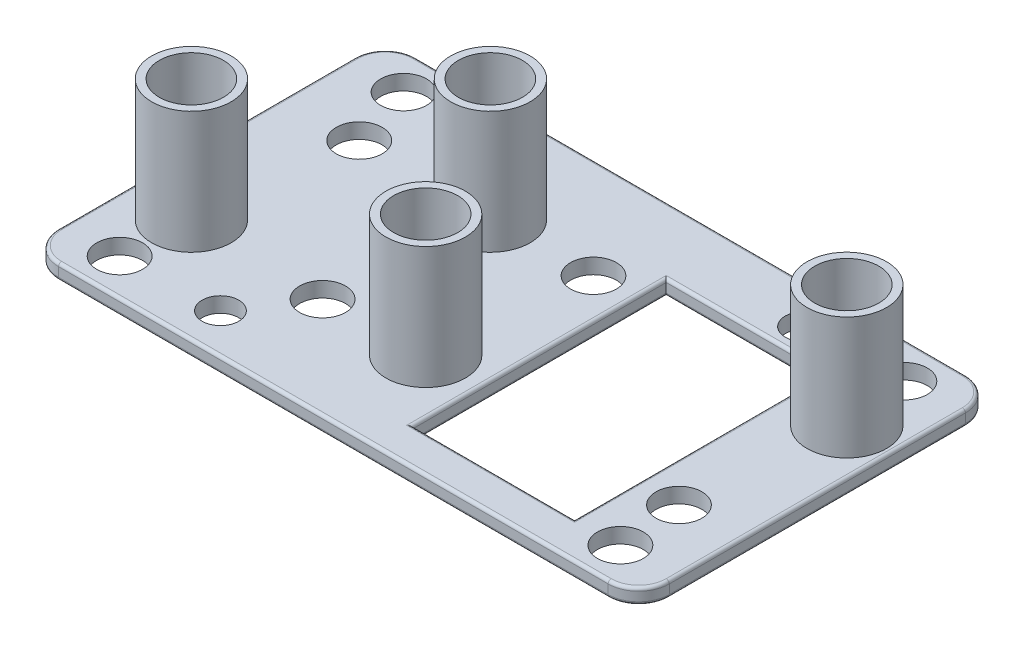
from build123d import *

# Parameters (mm, degrees)
SKETCH1_R                = 6
BOSS_EXTRUDE1_DEPTH      = 5
BOSS_EXTRUDE1_2_DEPTH    = 5
BOSS_EXTRUDE1_3_DEPTH    = 5
SKETCH1_W                = 200
SKETCH1_H                = 117
SKETCH1_R_2              = 7.5175
SKETCH1_R_3              = 7.5
SKETCH1_R_4              = 13.02
BOSS_EXTRUDE1_4_DEPTH    = 5
BOSS_EXTRUDE2_DEPTH      = 40
BOSS_EXTRUDE2_DEPTH_BACK = 5
SKETCH2_R                = 13.02
SKETCH3_R                = 10.5
CUT_EXTRUDE4_DEPTH       = 40
SKETCH4_R                = 3.75
CUT_EXTRUDE5_DEPTH       = 40
FILLET1_R                = 10
SKETCH5_R                = 6
CUT_EXTRUDE6_DEPTH       = 10
FILLET2_R                = 1
SKETCH6_W                = 53
SKETCH6_H                = 83
CUT_EXTRUDE15_DEPTH      = 10
FILLET3_R                = 1
FILLET4_R                = 1
FILLET5_R                = 1
FILLET6_R                = 1
FILLET7_R                = 1
FILLET8_R                = 1
SKETCH7_R                = 8
CUT_EXTRUDE16_DEPTH      = 10
FILLET9_R                = 1
FILLET10_R               = 1
FILLET11_R               = 1
FILLET12_R               = 1


with BuildPart() as part:
    # Sketch1 → Boss-Extrude1 (new body)
    with BuildSketch(Plane(origin=(0, 0, 0), x_dir=(1, 0, 0), z_dir=(0, 1, 0))):
        with Locations(Location((19.48757137, 34.02, 0), (0, 0, 270))):
            Circle(SKETCH1_R)
    extrude(amount=BOSS_EXTRUDE1_DEPTH)



with BuildPart() as body_2:
    # Sketch1 → Boss-Extrude1 2 (new body)
    with BuildSketch(Plane(origin=(0, 0, 0), x_dir=(1, 0, 0), z_dir=(0, 1, 0))):
        with Locations(Location((68.44757137, 82.98, 0), (0, 0, 270))):
            Circle(SKETCH1_R)
    extrude(amount=BOSS_EXTRUDE1_2_DEPTH)


with BuildPart() as body_3:
    # Sketch1 → Boss-Extrude1 3 (new body)
    with BuildSketch(Plane(origin=(0, 0, 0), x_dir=(1, 0, 0), z_dir=(0, 1, 0))):
        with Locations(Location((96.2091021, 34.02, 0), (0, 0, 270))):
            Circle(SKETCH1_R)
    extrude(amount=BOSS_EXTRUDE1_3_DEPTH)


with BuildPart() as body_4:
    # Sketch1 → Boss-Extrude1 4 (new body)
    with BuildSketch(Plane(origin=(0, 0, 0), x_dir=(1, 0, 0), z_dir=(0, 1, 0))):
        with Locations((100, 58.5)):
            Rectangle(SKETCH1_W, SKETCH1_H)
        with Locations(Location((18, 105, 0), (0, 0, 270))):
            Circle(SKETCH1_R_2, mode=Mode.SUBTRACT)
        with Locations(Location((18, 12, 0), (0, 0, 270))):
            Circle(SKETCH1_R_2, mode=Mode.SUBTRACT)
        with Locations(Location((182, 105, 0), (0, 0, 270))):
            Circle(SKETCH1_R_2, mode=Mode.SUBTRACT)
        with Locations(Location((182, 12, 0), (0, 0, 270))):
            Circle(SKETCH1_R_2, mode=Mode.SUBTRACT)
        with Locations(Location((24.46757137, 84, 0), (0, 0, 270))):
            Circle(SKETCH1_R_2, mode=Mode.SUBTRACT)
        with Locations(Location((63.46757137, 33, 0), (0, 0, 270))):
            Circle(SKETCH1_R_2, mode=Mode.SUBTRACT)
        with Locations(Location((101.1891021, 84, 0), (0, 0, 270))):
            Circle(SKETCH1_R_3, mode=Mode.SUBTRACT)
        with Locations(Location((180.1891021, 33, 0), (0, 0, 270))):
            Circle(SKETCH1_R_3, mode=Mode.SUBTRACT)
        with Locations(Location((96.2091021, 34.02, 0), (0, 0, 270))):
            Circle(SKETCH1_R_4, mode=Mode.SUBTRACT)
        with Locations(Location((185.1691021, 82.98, 0), (0, 0, 270))):
            Circle(SKETCH1_R_4, mode=Mode.SUBTRACT)
        with Locations(Location((68.44757137, 82.98, 0), (0, 0, 270))):
            Circle(SKETCH1_R_4, mode=Mode.SUBTRACT)
        with Locations(Location((19.48757137, 34.02, 0), (0, 0, 270))):
            Circle(SKETCH1_R_4, mode=Mode.SUBTRACT)
    extrude(amount=BOSS_EXTRUDE1_4_DEPTH)

    # Fillet1
    fillet1_edges = [body_4.edges().sort_by_distance(p)[0] for p in [
        (0, 2.5, -117),
        (0, 2.5, 0),
        (200, 2.5, 0),
        (200, 2.5, -117),
    ]]
    fillet(fillet1_edges, radius=FILLET1_R)

    # Sketch5 → Cut-Extrude6 (cut)
    with BuildSketch(Plane(origin=(0, 5, 0), x_dir=(1, 0, 0), z_dir=(0, 1, 0))):
        with Locations(Location((50, 13.02, 0), (0, 0, 270))):
            Circle(SKETCH5_R)
        with Locations(Location((150, 103.98, 0), (0, 0, 270))):
            Circle(SKETCH5_R)
    extrude(amount=-CUT_EXTRUDE6_DEPTH, mode=Mode.SUBTRACT)

    # Fillet2
    fillet2_edges = [body_4.edges().sort_by_distance(p)[0] for p in [
        (100, 0, -117),
        (100, 5, -117),
        (200, 0, -58.5),
        (100, 0, 0),
        (0, 0, -58.5),
        (197.071067812, 0, -2.928932188),
        (2.928932188, 0, -2.928932188),
        (2.928932188, 0, -114.071067812),
        (197.071067812, 0, -114.071067812),
        (200, 5, -58.5),
        (0, 5, -58.5),
        (100, 5, 0),
        (197.071067812, 5, -2.928932188),
        (2.928932188, 5, -2.928932188),
        (2.928932188, 5, -114.071067812),
        (197.071067812, 5, -114.071067812),
    ]]
    fillet(fillet2_edges, radius=FILLET2_R)

    # Sketch6 → Cut-Extrude15 (cut)
    with BuildSketch(Plane(origin=(0, 5, 0), x_dir=(1, 0, 0), z_dir=(0, 1, 0))):
        with Locations((140.5, 53.5)):
            Rectangle(SKETCH6_W, SKETCH6_H)
    extrude(amount=-CUT_EXTRUDE15_DEPTH, mode=Mode.SUBTRACT)

    # Fillet3
    fillet3_edges = [body_4.edges().sort_by_distance(p)[0] for p in [
        (167, 0, -53.5),
        (140.5, 0, -95),
        (114, 0, -53.5),
        (114, 5, -53.5),
        (140.5, 5, -12),
        (167, 5, -53.5),
        (140.5, 5, -95),
    ]]
    fillet(fillet3_edges, radius=FILLET3_R)

    # Fillet4
    fillet4_edges = [body_4.edges().sort_by_distance(p)[0] for p in [
        (140.5, 0, -12),
    ]]
    fillet(fillet4_edges, radius=FILLET4_R)


with BuildPart() as part_1:
    add(part.part)

    add(body_2.part)  # Boss-Extrude2 merges body 2

    add(body_3.part)  # Boss-Extrude2 merges body 3
    # Sketch2 → Boss-Extrude2 (add, two sides: drawn at the far end of the back side and taken through both)
    with BuildSketch(Plane(origin=(0, 5, 0), x_dir=(1, 0, 0), z_dir=(0, 1, 0)).offset(-BOSS_EXTRUDE2_DEPTH_BACK)):
        with Locations(Location((185.1691021, 82.98, 0), (0, 0, 270))):
            Circle(SKETCH2_R)
        with Locations(Location((96.2091021, 34.02, 0), (0, 0, 270))):
            Circle(SKETCH2_R)
        with Locations(Location((68.44757137, 82.98, 0), (0, 0, 270))):
            Circle(SKETCH2_R)
        with Locations(Location((19.48757137, 34.02, 0), (0, 0, 270))):
            Circle(SKETCH2_R)
    extrude(amount=BOSS_EXTRUDE2_DEPTH + BOSS_EXTRUDE2_DEPTH_BACK)

    # Sketch3 → Cut-Extrude4 (cut)
    with BuildSketch(Plane(origin=(0, 5, 0), x_dir=(1, 0, 0), z_dir=(0, 1, 0))):
        with Locations(Location((19.48757137, 34.02, 0), (0, 0, 270))):
            Circle(SKETCH3_R)
        with Locations(Location((96.2091021, 34.02, 0), (0, 0, 270))):
            Circle(SKETCH3_R)
        with Locations(Location((185.1691021, 82.98, 0), (0, 0, 270))):
            Circle(SKETCH3_R)
        with Locations(Location((68.44757137, 82.98, 0), (0, 0, 270))):
            Circle(SKETCH3_R)
    extrude(amount=CUT_EXTRUDE4_DEPTH, mode=Mode.SUBTRACT)

    # Sketch4 → Cut-Extrude5 (cut)
    with BuildSketch(Plane.XZ):
        with Locations(Location((19.48757137, -34.02, 0), (0, 0, 270))):
            Circle(SKETCH4_R)
        with Locations(Location((68.44757137, -82.98, 0), (0, 0, 270))):
            Circle(SKETCH4_R)
        with Locations(Location((96.2091021, -34.02, 0), (0, 0, 270))):
            Circle(SKETCH4_R)
        with Locations(Location((185.1691021, -82.98, 0), (0, 0, 270))):
            Circle(SKETCH4_R)
    extrude(amount=-CUT_EXTRUDE5_DEPTH, mode=Mode.SUBTRACT)

    # Fillet5
    fillet5_edges = [part_1.edges().sort_by_distance(p)[0] for p in [
        (68.44757137, 5, -79.23),
    ]]
    fillet(fillet5_edges, radius=FILLET5_R)

    # Fillet6
    fillet6_edges = [part_1.edges().sort_by_distance(p)[0] for p in [
        (19.48757137, 5, -30.27),
    ]]
    fillet(fillet6_edges, radius=FILLET6_R)

    # Fillet7
    fillet7_edges = [part_1.edges().sort_by_distance(p)[0] for p in [
        (96.2091021, 5, -30.27),
    ]]
    fillet(fillet7_edges, radius=FILLET7_R)

    # Fillet8
    fillet8_edges = [part_1.edges().sort_by_distance(p)[0] for p in [
        (185.1691021, 5, -79.23),
    ]]
    fillet(fillet8_edges, radius=FILLET8_R)

    # Sketch7 → Cut-Extrude16 (cut)
    with BuildSketch(Plane.XZ):
        with Locations(Location((19.48757137, -34.02, 0), (0, 0, 270))):
            Circle(SKETCH7_R)
        with Locations(Location((96.2091021, -34.02, 0), (0, 0, 270))):
            Circle(SKETCH7_R)
        with Locations(Location((68.44757137, -82.98, 0), (0, 0, 270))):
            Circle(SKETCH7_R)
        with Locations(Location((185.1691021, -82.98, 0), (0, 0, 270))):
            Circle(SKETCH7_R)
    extrude(amount=-CUT_EXTRUDE16_DEPTH, mode=Mode.SUBTRACT)

    # Fillet9
    fillet9_edges = [part_1.edges().sort_by_distance(p)[0] for p in [
        (185.1691021, 0, -74.98),
    ]]
    fillet(fillet9_edges, radius=FILLET9_R)

    # Fillet10
    fillet10_edges = [part_1.edges().sort_by_distance(p)[0] for p in [
        (19.48757137, 0, -26.02),
    ]]
    fillet(fillet10_edges, radius=FILLET10_R)

    # Fillet11
    fillet11_edges = [part_1.edges().sort_by_distance(p)[0] for p in [
        (96.2091021, 0, -26.02),
    ]]
    fillet(fillet11_edges, radius=FILLET11_R)

    # Fillet12
    fillet12_edges = [part_1.edges().sort_by_distance(p)[0] for p in [
        (68.44757137, 0, -74.98),
    ]]
    fillet(fillet12_edges, radius=FILLET12_R)


solid = Compound([body_4.part, part_1.part])
